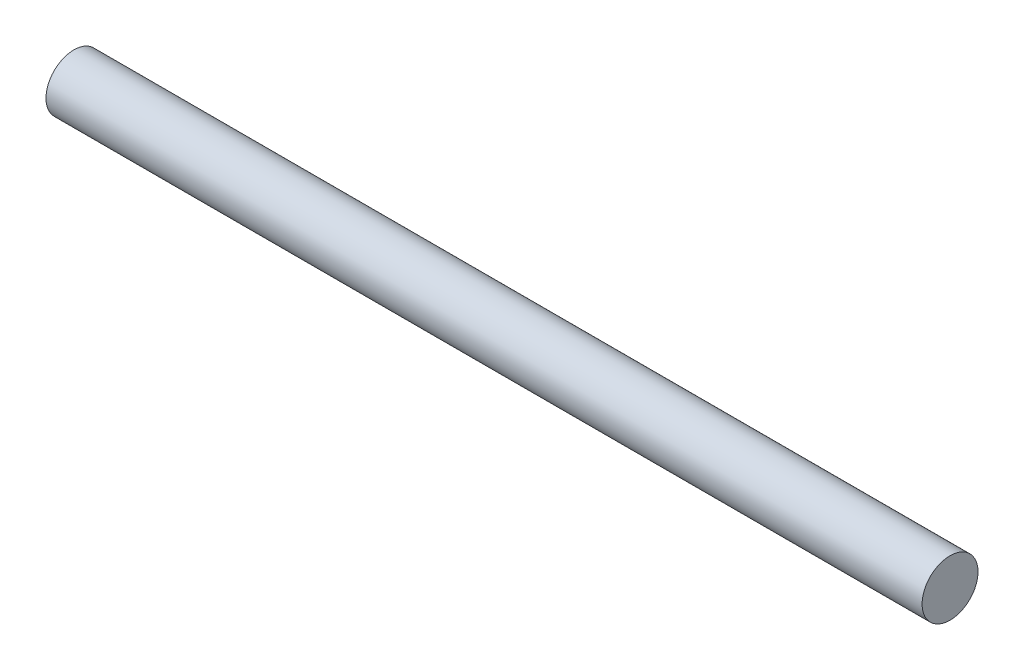
from build123d import *

# Parameters (mm, degrees)
SKETCH1_R           = 1.5
BOSS_EXTRUDE1_DEPTH = 47


with BuildPart() as part:
    # Sketch1 → Boss-Extrude1 (new body)
    with BuildSketch(Plane(origin=(0, 0, 0), x_dir=(0, 0, -1), z_dir=(1, 0, 0))):
        Circle(SKETCH1_R)
    extrude(amount=BOSS_EXTRUDE1_DEPTH)


solid = part.part
